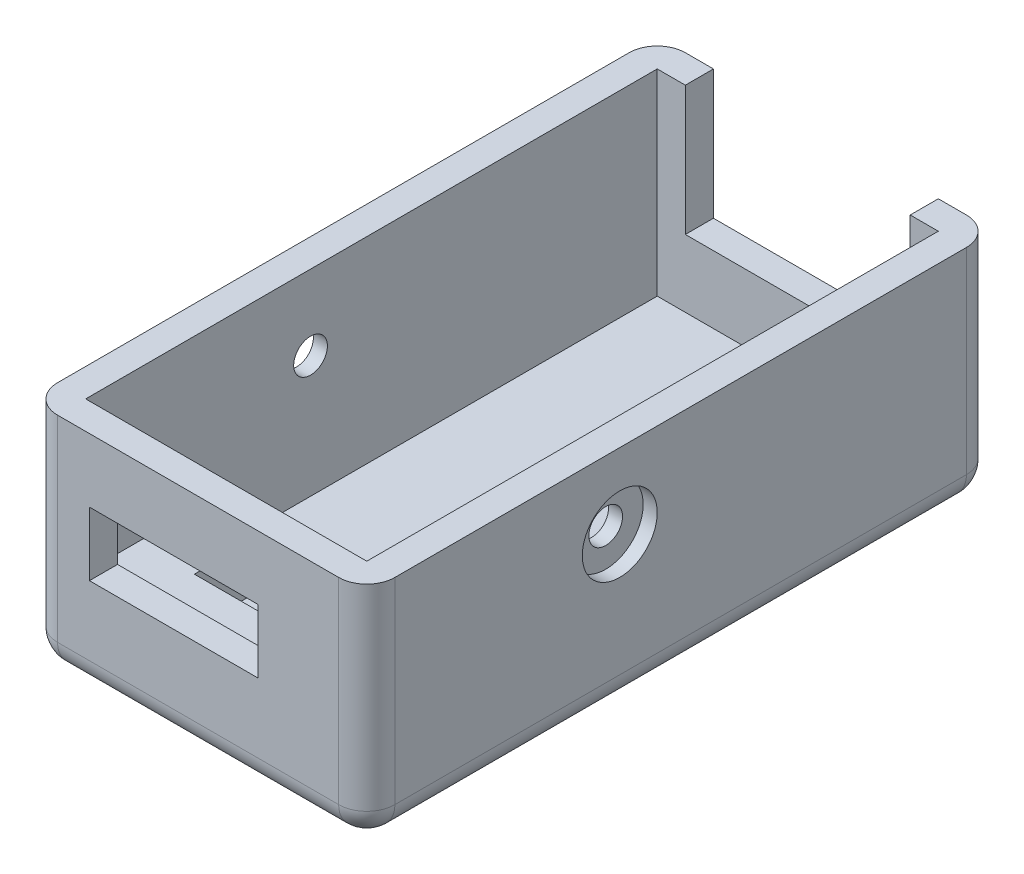
from build123d import *

# Parameters (mm, degrees)
SKETCH_1_W          = 18
SKETCH_1_H          = 33.5
EXTRUDE_1_DEPTH     = 12
SHELL_1_T           = -1.5
FILLET_1_R          = 1.5
SKETCH_2_W          = 15
SKETCH_2_H          = 5.3
EXTRUDE_2_DEPTH     = 2.5
SKETCH_4_W          = 6
SKETCH_4_H          = 2.5
CUT_EXTRUDE_1_DEPTH = 2.5
FILLET_3_R          = 1.5
SKETCH_5_W          = 9
SKETCH_5_H          = 3.4
CUT_EXTRUDE_2_DEPTH = 2.5
SKETCH_6_W          = 12
SKETCH_6_H          = 8
CUT_EXTRUDE_3_DEPTH = 2.5
SKETCH_7_R          = 0.9
CUT_EXTRUDE_4_DEPTH = 3
SKETCH_8_R          = 0.9
CUT_EXTRUDE_5_DEPTH = 23.5
SKETCH_10_R         = 2
CUT_EXTRUDE_7_DEPTH = 0.75
CUT_EXTRUDE_START   = -0.75
SKETCH_11_R         = 2
CUT_EXTRUDE_8_DEPTH = 0.75


with BuildPart() as part:
    # 草图1 → 凸台-拉伸1 (new body)
    with BuildSketch(Plane(origin=(0, 0, 0), x_dir=(1, 0, 0), z_dir=(0, 1, 0))):
        Rectangle(SKETCH_1_W, SKETCH_1_H)
    extrude(amount=EXTRUDE_1_DEPTH)

    # 抽壳1
    shell_1_openings = [part.faces().sort_by_distance(p)[0] for p in [
        (0, 12, 0),
    ]]
    offset(amount=SHELL_1_T, openings=shell_1_openings, kind=Kind.INTERSECTION)

    # 圆角1
    fillet_1_edges = [part.edges().sort_by_distance(p)[0] for p in [
        (0, 0, -16.75),
        (9, 0, 0),
        (0, 0, 16.75),
        (-9, 0, 0),
        (-9, 6, -16.75),
        (9, 6, -16.75),
        (9, 6, 16.75),
        (-9, 6, 16.75),
    ]]
    fillet(fillet_1_edges, radius=FILLET_1_R)

    # 草图2 → 凸台-拉伸2 (add)
    with BuildSketch(Plane(origin=(0, 1.5, 0), x_dir=(1, 0, 0), z_dir=(0, 1, 0))):
        with Locations((0, -12.6)):
            Rectangle(SKETCH_2_W, SKETCH_2_H)
    extrude(amount=EXTRUDE_2_DEPTH)

    # 草图4 → 切除-拉伸1 (cut)
    with BuildSketch(Plane(origin=(0, 4, 0), x_dir=(1, 0, 0), z_dir=(0, 1, 0))):
        with Locations((-1.5, -11.2)):
            Rectangle(SKETCH_4_W, SKETCH_4_H)
    extrude(amount=-CUT_EXTRUDE_1_DEPTH, mode=Mode.SUBTRACT)

    # 圆角3
    fillet_3_edges = [part.edges().sort_by_distance(p)[0] for p in [
        (4.5, 1.5, 9.95),
        (-6, 1.5, 9.95),
    ]]
    fillet(fillet_3_edges, radius=FILLET_3_R)

    # 草图5 → 切除-拉伸2 (cut)
    with BuildSketch(Plane(origin=(0, 0, 15.25), x_dir=(-1, 0, 0), z_dir=(0, 0, -1))):
        with Locations((1.3, 6.9)):
            Rectangle(SKETCH_5_W, SKETCH_5_H)
    extrude(amount=-CUT_EXTRUDE_2_DEPTH, mode=Mode.SUBTRACT)

    # 草图6 → 切除-拉伸3 (cut)
    with BuildSketch(Plane(origin=(0, 0, -16.75), x_dir=(-1, 0, 0), z_dir=(0, 0, -1))):
        with Locations((0, 9.1)):
            Rectangle(SKETCH_6_W, SKETCH_6_H)
    extrude(amount=-CUT_EXTRUDE_3_DEPTH, mode=Mode.SUBTRACT)

    # 草图7 → 切除-拉伸4 (cut)
    with BuildSketch(Plane(origin=(0, 4, 0), x_dir=(1, 0, 0), z_dir=(0, 1, 0))):
        with Locations(Location((5.3, -11.55, 0), (0, 0, 270))):
            Circle(SKETCH_7_R)
    extrude(amount=-CUT_EXTRUDE_4_DEPTH, mode=Mode.SUBTRACT)

    # 草图8 → 切除-拉伸5 (cut)
    with BuildSketch(Plane(origin=(9, 0, 0), x_dir=(0, 0, -1), z_dir=(1, 0, 0))):
        with Locations((-3.25, 8)):
            Circle(SKETCH_8_R)
    extrude(amount=-CUT_EXTRUDE_5_DEPTH, mode=Mode.SUBTRACT)

    # 草图10 → 切除-拉伸7 (cut)
    with BuildSketch(Plane(origin=(9, 0, 0), x_dir=(0, 0, -1), z_dir=(1, 0, 0))):
        with Locations((-3.25, 8)):
            Circle(SKETCH_10_R)
    extrude(amount=-CUT_EXTRUDE_7_DEPTH, mode=Mode.SUBTRACT)

    # 草图11 → 切除-拉伸8 (cut)
    with BuildSketch(Plane.ZY.offset(9).offset(CUT_EXTRUDE_START)):
        with Locations(Location((3.25, 8, 0), (0, 0, 180))):
            Circle(SKETCH_11_R)
    extrude(amount=CUT_EXTRUDE_8_DEPTH, mode=Mode.SUBTRACT)


solid = part.part
